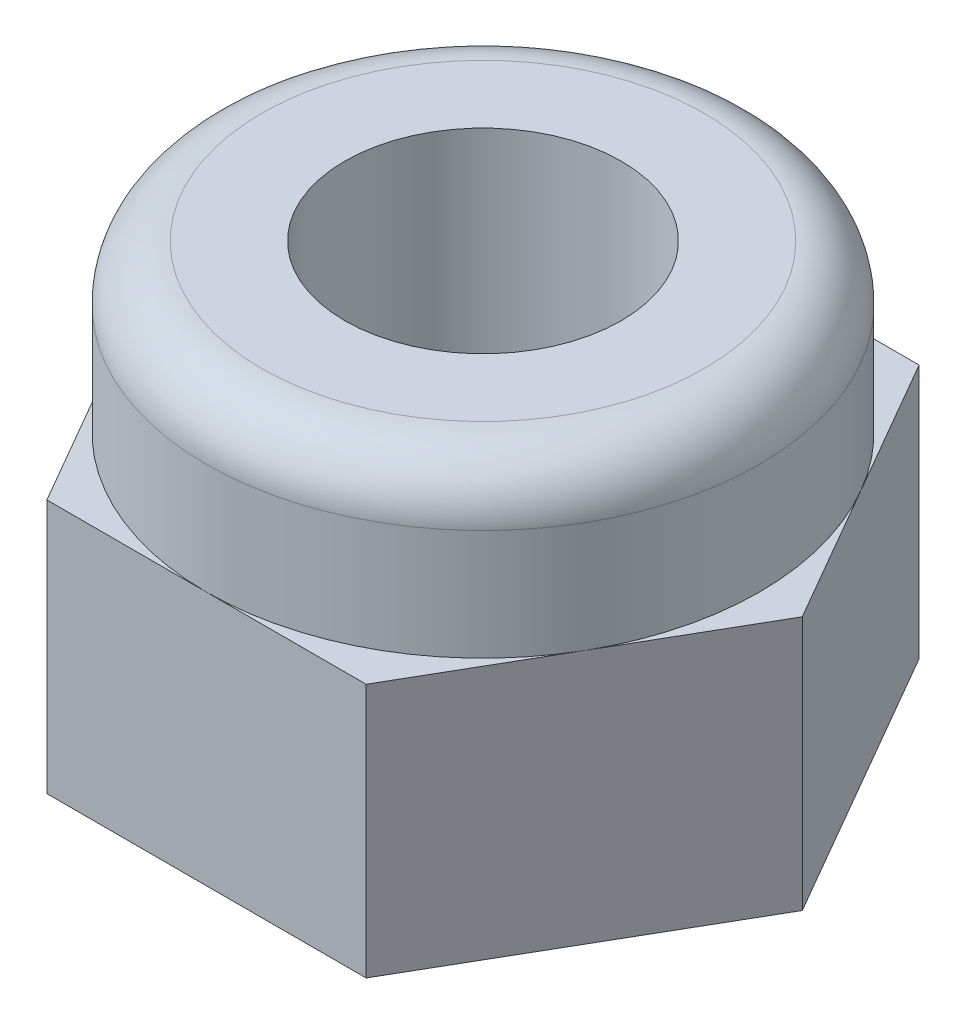
from build123d import *

# Parameters (mm, degrees)
ESQUISSE1_R        = 1.25
BOSS_EXTRU_1_DEPTH = 2.3
ESQUISSE2_R        = 2.5
ESQUISSE2_R_2      = 1.25
BOSS_EXTRU_2_DEPTH = 1.5
CONG_1_R           = 0.5


with BuildPart() as part:
    # Esquisse1 → Boss.-Extru.1 (new body)
    with BuildSketch(Plane(origin=(0, 0, 0), x_dir=(1, 0, 0), z_dir=(0, 1, 0))):
        Polygon((2.886751346, 0), (1.443375673, 2.5), (-1.443375673, 2.5), (-2.886751346, 0), (-1.443375673, -2.5), (1.443375673, -2.5), align=None)
        with Locations(Location((0, 0, 0), (0, 0, 270))):
            Circle(ESQUISSE1_R, mode=Mode.SUBTRACT)
    extrude(amount=BOSS_EXTRU_1_DEPTH)

    # Esquisse2 → Boss.-Extru.2 (add)
    with BuildSketch(Plane(origin=(0, 2.3, 0), x_dir=(1, 0, 0), z_dir=(0, 1, 0))):
        with Locations(Location((0, 0, 0), (0, 0, 270))):
            Circle(ESQUISSE2_R)
        with Locations(Location((0, 0, 0), (0, 0, 270))):
            Circle(ESQUISSE2_R_2, mode=Mode.SUBTRACT)
    extrude(amount=BOSS_EXTRU_2_DEPTH)

    # Congé1
    cong_1_edges = [part.edges().sort_by_distance(p)[0] for p in [
        (0, 3.8, -2.5),
    ]]
    fillet(cong_1_edges, radius=CONG_1_R)


solid = part.part
